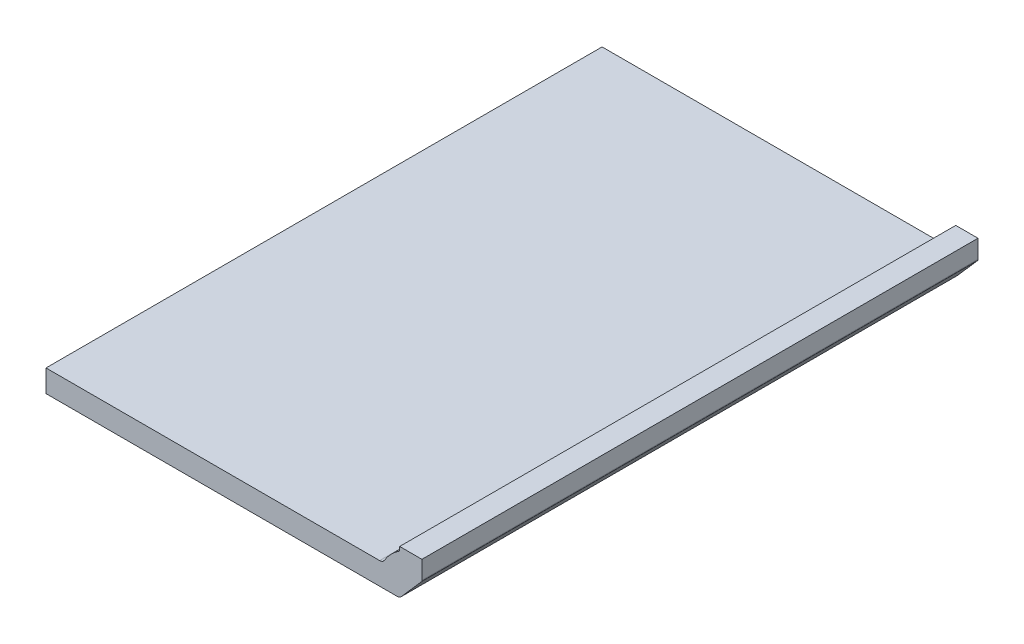
from build123d import *

# Parameters (mm, degrees)
BOSS_EXTRUDE1_DEPTH = 50


with BuildPart() as part:
    # Sketch1 → Boss-Extrude1 (new body)
    with BuildSketch(Plane.XY):
        with BuildLine():
            Line((-0.226533162, 0), (-31.8, 0))
            Line((-31.8, 0), (-31.8, 2))
            Line((-31.8, 2), (-1.79756025, 2))
            ThreePointArc((-1.79756025, 2), (-1.552823997, 2.063990635), (-1.370731057, 2.239583333))
            ThreePointArc((-1.370731057, 2.239583333), (-0.802551257, 2.977276557), (-0.088888889, 3.575361503))
            ThreePointArc((-0.088888889, 3.575361503), (-0.023616579, 3.647376483), (0, 3.741657387))
            Line((0, 3.741657387), (0, 4))
            Line((0, 4), (2, 4))
            Line((2, 4), (2, 2.355630783))
            ThreePointArc((2, 2.355630783), (1.987179561, 2.285176459), (1.950361882, 2.223754688))
            Line((1.950361882, 2.223754688), (0.149371544, 0.170309763))
            ThreePointArc((0.149371544, 0.170309763), (-0.020190145, 0.044563331), (-0.226533162, 0))
        make_face()
    extrude(amount=-BOSS_EXTRUDE1_DEPTH)


solid = part.part
